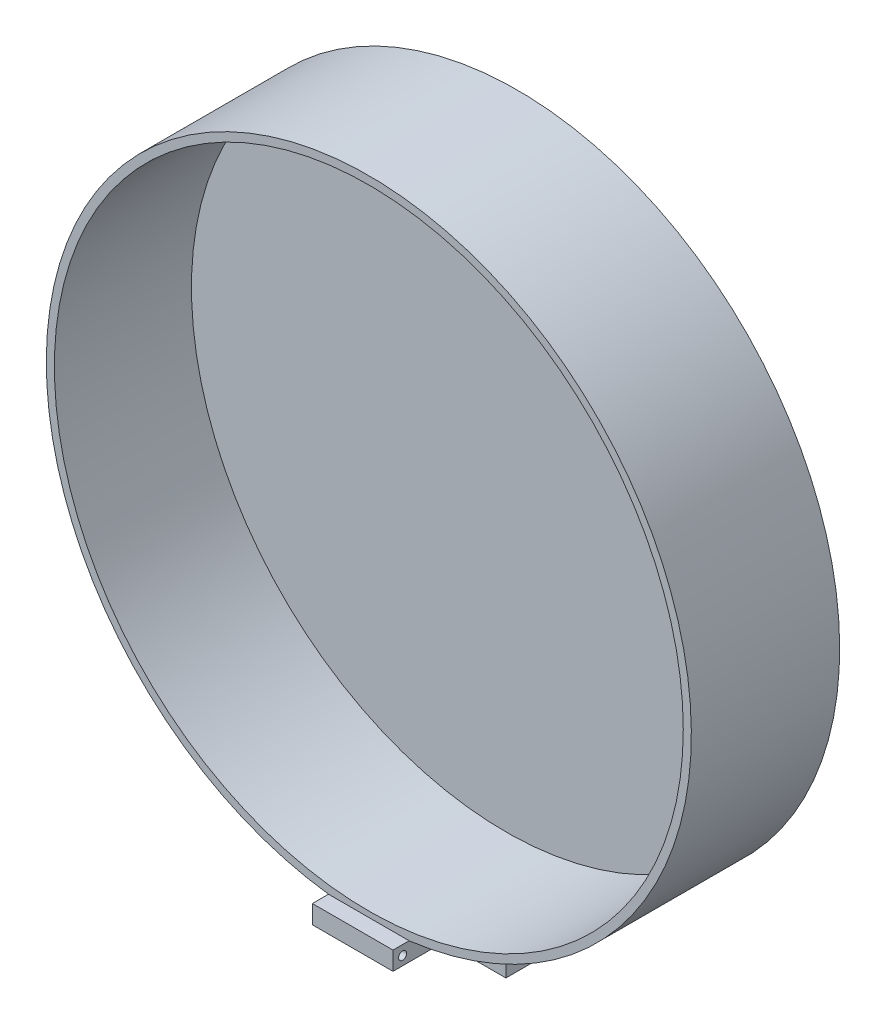
from build123d import *
from build123d.topology import SkipClean

# Parameters (mm, degrees)
BOSS_EXTRUDE1_DEPTH = 23.368
SKETCH4_R           = 49.53
CUT_EXTRUDE1_DEPTH  = 21.59
CUT_EXTRUDE2_START  = -15.24
CUT_EXTRUDE2_DEPTH  = 15.24
BOSS_EXTRUDE2_DEPTH = 15.24
SKETCH8_W           = 12.7
SKETCH8_H           = 2.905378661
BOSS_EXTRUDE3_DEPTH = 2.54
SKETCH9_R           = 0.635
CUT_EXTRUDE4_DEPTH  = 131.041965913


with BuildPart() as part:
    # Sketch1 → Boss-Extrude1 (new body)
    with BuildSketch(Plane.XY):
        with BuildLine():
            Line((0, 0), (12.7, 0))
            Line((12.7, 0), (12.7, 12.7))
            ThreePointArc((12.7, 12.7), (6.35, 113.901562476), (0, 12.7))
            Line((0, 12.7), (0, 0))
        make_face()
    extrude(amount=BOSS_EXTRUDE1_DEPTH)

    # Sketch4 → Cut-Extrude1 (cut)
    with BuildSketch(Plane.XY.offset(23.368)):
        with Locations((6.35, 63.101562476)):
            Circle(SKETCH4_R)
    extrude(amount=-CUT_EXTRUDE1_DEPTH, mode=Mode.SUBTRACT)

    # Sketch5 → Cut-Extrude2 (cut)
    with SkipClean():  # the faces are left unmerged after this step: merging them gives an invalid solid
        with BuildSketch(Plane.XY.offset(23.368).offset(CUT_EXTRUDE2_START)):
            with BuildLine():
                Line((0, 0), (12.7, 0))
                Line((12.7, 0), (12.7, 12.7))
                ThreePointArc((12.7, 12.7), (6.35, 12.301562476), (0, 12.7))
                Line((0, 12.7), (0, 0))
            make_face()
        extrude(amount=CUT_EXTRUDE2_DEPTH, mode=Mode.SUBTRACT)

    # Sketch6 → Boss-Extrude2 (add)
    with BuildSketch(Plane.XY.offset(8.128)):
        with BuildLine():
            Line((12.7, 9.794621339), (0, 9.794621339))
            Line((0, 9.794621339), (0, 12.7))
            ThreePointArc((0, 12.7), (6.35, 12.301562476), (12.7, 12.7))
            Line((12.7, 12.7), (12.7, 9.794621339))
        make_face()
    extrude(amount=BOSS_EXTRUDE2_DEPTH)

    # Sketch8 → Boss-Extrude3 (add)
    with BuildSketch(Plane.XY.offset(23.368)):
        with Locations((6.35, 11.24731067)):
            Rectangle(SKETCH8_W, SKETCH8_H)
    extrude(amount=BOSS_EXTRUDE3_DEPTH)

    # Sketch9 → Cut-Extrude4 (cut, through all)
    with BuildSketch(Plane.ZY):
        with Locations((24.394843598, 11.189256607)):
            Circle(SKETCH9_R)
    extrude(amount=-CUT_EXTRUDE4_DEPTH, mode=Mode.SUBTRACT)


solid = part.part
